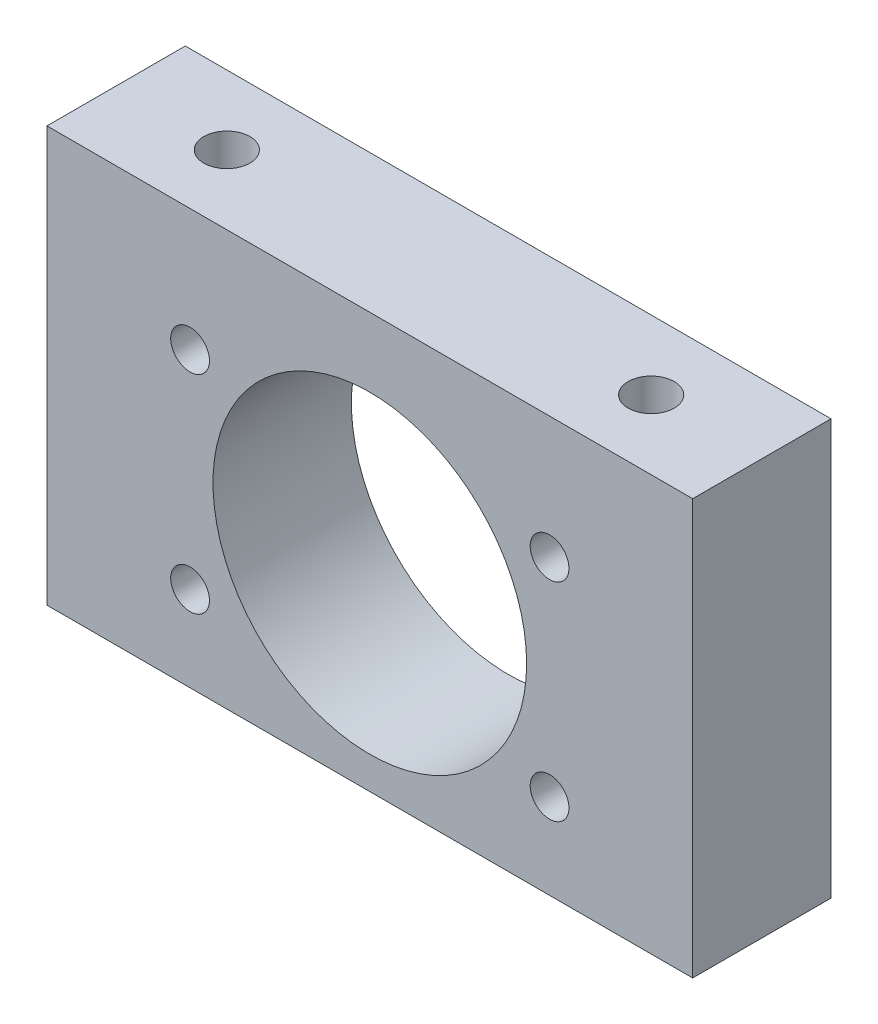
from build123d import *

# Parameters (mm, degrees)
SKETCH_1_W             = 70
SKETCH_1_H             = 45
EXTRUDE_1_DEPTH        = 15
SKETCH_2_R             = 17
CUT_EXTRUDE_1_DEPTH    = 85.557672626
HOLE_WIZARD_M6_1_D     = 5
HOLE_WIZARD_M6_1_DEPTH = 15
HOLE_WIZARD_M6_1_TIP   = 1.502151548
HOLE_WIZARD_M5_1_D     = 4.2
HOLE_WIZARD_M5_1_DEPTH = 12.4
HOLE_WIZARD_M5_1_TIP   = 1.2618073


with BuildPart() as part:
    # 草图1 → 凸台-拉伸1 (new body)
    with BuildSketch(Plane.XY):
        with Locations((35, 22.5)):
            Rectangle(SKETCH_1_W, SKETCH_1_H)
    extrude(amount=EXTRUDE_1_DEPTH)

    # 草图2 → 切除-拉伸1 (cut, through all)
    with BuildSketch(Plane.XY.offset(15)):
        with Locations((35, 20.5)):
            Circle(SKETCH_2_R)
    extrude(amount=-CUT_EXTRUDE_1_DEPTH, mode=Mode.SUBTRACT)

    # M6 螺纹孔1
    with Locations(Plane(origin=(0, 45, 0), x_dir=(-1, 0, 0), z_dir=(0, 1, 0))):
        with Locations((-12, 7.5), (-58, 7.5)):
            Hole(HOLE_WIZARD_M6_1_D / 2, depth=HOLE_WIZARD_M6_1_DEPTH)
            with Locations((0, 0, -(HOLE_WIZARD_M6_1_DEPTH + HOLE_WIZARD_M6_1_TIP / 2))):  # 118° drill point
                Cone(0, HOLE_WIZARD_M6_1_D / 2, HOLE_WIZARD_M6_1_TIP, mode=Mode.SUBTRACT)

    # M5 螺纹孔1
    with Locations(Plane.XY.offset(15)):
        with Locations((54.485571585, 31.75), (15.514428415, 31.75), (54.485571585, 9.25), (15.514428415, 9.25)):
            Hole(HOLE_WIZARD_M5_1_D / 2, depth=HOLE_WIZARD_M5_1_DEPTH)
            with Locations((0, 0, -(HOLE_WIZARD_M5_1_DEPTH + HOLE_WIZARD_M5_1_TIP / 2))):  # 118° drill point
                Cone(0, HOLE_WIZARD_M5_1_D / 2, HOLE_WIZARD_M5_1_TIP, mode=Mode.SUBTRACT)


solid = part.part
